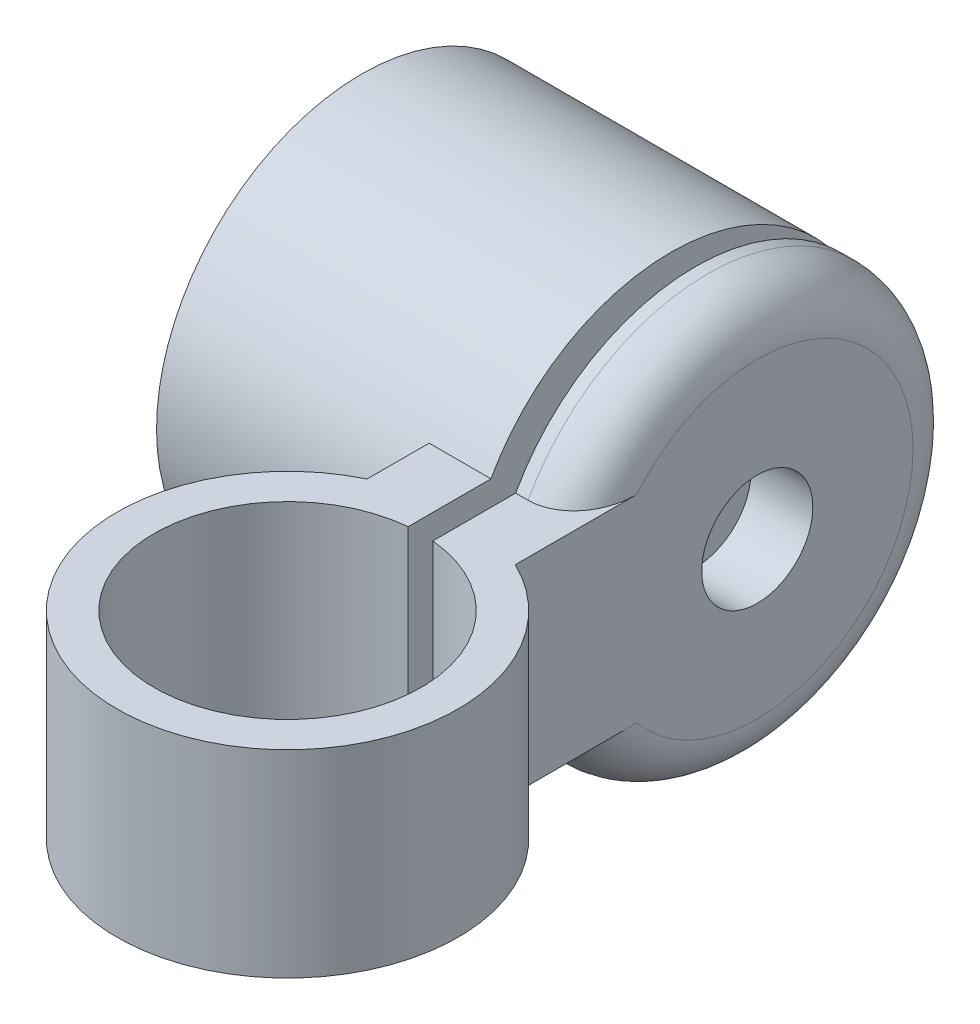
from build123d import *

# Parameters (mm, degrees)
BOSS_EXTRUDE1_DEPTH   = 8
F_8_CLEARANCE_HOLE1_D = 4.4958
SKETCH5_R             = 8.3
SKETCH5_R_2           = 6.3
BOSS_EXTRUDE2_DEPTH   = 10
BOSS_EXTRUDE3_DEPTH   = 2.5
BOSS_EXTRUDE4_START   = 3.5
BOSS_EXTRUDE4_DEPTH   = 2.5
FILLET1_R             = 2
CHAMFER1_SIZE         = 1
CHAMFER1_SIZE2        = 1.732050808


with BuildPart() as part:
    # Sketch1 → Boss-Extrude1 (new body)
    with BuildSketch(Plane(origin=(0, 0, 0), x_dir=(1, 0, 0), z_dir=(0, 1, 0))):
        with BuildLine():
            Line((3, 6.213694553), (3, 20))
            Line((3, 20), (0.5, 20))
            Line((0.5, 20), (0.5, 5.376802024))
            ThreePointArc((0.5, 5.376802024), (0, -5.4), (-0.5, 5.376802024))
            Line((-0.5, 5.376802024), (-0.5, 20))
            Line((-0.5, 20), (-3, 20))
            Line((-3, 20), (-3, 6.213694553))
            ThreePointArc((-3, 6.213694553), (0, -6.9), (3, 6.213694553))
        make_face()
    extrude(amount=BOSS_EXTRUDE1_DEPTH)

    # #8 Clearance Hole1 (through all)
    with Locations(Plane(origin=(3, 0, 0), x_dir=(0, 0, -1), z_dir=(1, 0, 0))):
        with Locations((16, 4)):
            Hole(F_8_CLEARANCE_HOLE1_D / 2)

    # Sketch5 → Boss-Extrude2 (add)
    with BuildSketch(Plane.ZY.offset(3)):
        with Locations(Location((-16, 4, 0), (0, 0, 331.188620291))):
            Circle(SKETCH5_R)
        with Locations(Location((-16, 4, 0), (0, 0, 320.585901644))):
            Circle(SKETCH5_R_2, mode=Mode.SUBTRACT)
    extrude(amount=BOSS_EXTRUDE2_DEPTH)

    # Sketch6 → Boss-Extrude3 (add)
    with BuildSketch(Plane(origin=(-0.5, 0, 0), x_dir=(0, 0, -1), z_dir=(1, 0, 0))):
        with BuildLine():
            Line((20, 0), (8.727448866, 0))
            ThreePointArc((8.727448866, 0), (24.3, 4), (8.727448866, 8))
            Line((8.727448866, 8), (20, 8))
            Line((20, 8), (20, 0))
        make_face()
    extrude(amount=-BOSS_EXTRUDE3_DEPTH)

    # Sketch6<4> → Boss-Extrude4 (add)
    with BuildSketch(Plane(origin=(-0.5, 0, 0), x_dir=(0, 0, -1), z_dir=(1, 0, 0)).offset(BOSS_EXTRUDE4_START)):
        with BuildLine():
            Line((20, 0), (8.727448866, 0))
            ThreePointArc((8.727448866, 0), (24.3, 4), (8.727448866, 8))
            Line((8.727448866, 8), (20, 8))
            Line((20, 8), (20, 0))
        make_face()
    extrude(amount=-BOSS_EXTRUDE4_DEPTH)

    # Fillet1
    fillet1_edges = [part.edges().sort_by_distance(p)[0] for p in [
        (3, 4, -24.3),
    ]]
    fillet(fillet1_edges, radius=FILLET1_R)

    # Chamfer1
    chamfer1_edges = [part.edges().sort_by_distance(p)[0] for p in [
        (-3, 4, -9.7),
    ]]
    chamfer1_side = [part.faces().sort_by_distance(p)[0] for p in [
        (-3, 0.130418557, -15.566381295),
    ]]
    chamfer(chamfer1_edges, length=CHAMFER1_SIZE, length2=CHAMFER1_SIZE2, reference=chamfer1_side[0])


solid = part.part
